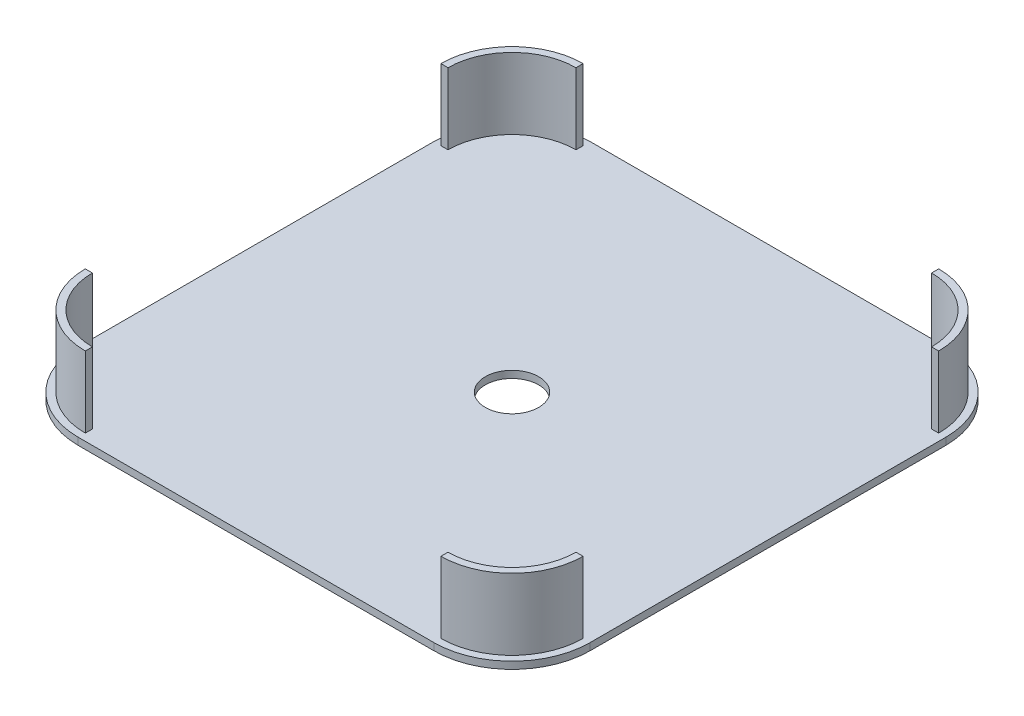
from build123d import *

# Parameters (mm, degrees)
BOSS_EXTRU_1_DEPTH      = 2
BOSS_EXTRU_2_DEPTH      = 20
ESQUISSE4_R             = 7.5
ENL_V_MAT_EXTRU_1_DEPTH = 138.403473125


with BuildPart() as part:
    # Esquisse1 → Boss.-Extru.1 (new body)
    with BuildSketch(Plane(origin=(0, 0, 0), x_dir=(1, 0, 0), z_dir=(0, 1, 0))):
        with BuildLine():
            Line((-56.655462185, 33.12605042), (43.344537815, 33.12605042))
            ThreePointArc((43.344537815, 33.12605042), (58.900887001, 26.682399606), (65.344537815, 11.12605042))
            Line((65.344537815, 11.12605042), (65.344537815, -88.87394958))
            ThreePointArc((65.344537815, -88.87394958), (58.900887001, -104.430298766), (43.344537815, -110.87394958))
            Line((43.344537815, -110.87394958), (-56.655462185, -110.87394958))
            ThreePointArc((-56.655462185, -110.87394958), (-72.211811371, -104.430298766), (-78.655462185, -88.87394958))
            Line((-78.655462185, -88.87394958), (-78.655462185, 11.12605042))
            ThreePointArc((-78.655462185, 11.12605042), (-72.211811371, 26.682399606), (-56.655462185, 33.12605042))
        make_face()
    extrude(amount=BOSS_EXTRU_1_DEPTH)

    # Esquisse3 → Boss.-Extru.2 (add)
    with BuildSketch(Plane(origin=(0, 2, 0), x_dir=(1, 0, 0), z_dir=(0, 1, 0))):
        with BuildLine():
            Line((43.344537815, 31.12605042), (43.344537815, 29.12605042))
            ThreePointArc((43.344537815, 29.12605042), (56.072459876, 23.853972482), (61.344537815, 11.12605042))
            Line((61.344537815, 11.12605042), (63.344537815, 11.12605042))
            ThreePointArc((63.344537815, 11.12605042), (57.486673439, 25.268186044), (43.344537815, 31.12605042))
        make_face()
        with BuildLine():
            Line((43.344537815, -106.87394958), (43.344537815, -108.87394958))
            ThreePointArc((43.344537815, -108.87394958), (57.486673439, -103.016085204), (63.344537815, -88.87394958))
            Line((63.344537815, -88.87394958), (61.344537815, -88.87394958))
            ThreePointArc((61.344537815, -88.87394958), (56.072459876, -101.601871641), (43.344537815, -106.87394958))
        make_face()
        with BuildLine():
            Line((-76.655462185, -88.87394958), (-74.655462185, -88.87394958))
            ThreePointArc((-74.655462185, -88.87394958), (-69.383384246, -101.601871641), (-56.655462185, -106.87394958))
            Line((-56.655462185, -106.87394958), (-56.655462185, -108.87394958))
            ThreePointArc((-56.655462185, -108.87394958), (-70.797597809, -103.016085204), (-76.655462185, -88.87394958))
        make_face()
        with BuildLine():
            Line((-76.655462185, 11.12605042), (-74.655462185, 11.12605042))
            ThreePointArc((-74.655462185, 11.12605042), (-69.383384246, 23.853972482), (-56.655462185, 29.12605042))
            Line((-56.655462185, 29.12605042), (-56.655462185, 31.12605042))
            ThreePointArc((-56.655462185, 31.12605042), (-70.797597809, 25.268186044), (-76.655462185, 11.12605042))
        make_face()
    extrude(amount=BOSS_EXTRU_2_DEPTH)

    # Esquisse4 → Enlèv. mat.-Extru.1 (cut, through all)
    with BuildSketch(Plane(origin=(0, 2, 0), x_dir=(1, 0, 0), z_dir=(0, 1, 0))):
        with Locations(Location((-6.655462185, -38.87394958, 0), (0, 0, 270))):
            Circle(ESQUISSE4_R)
    extrude(amount=-ENL_V_MAT_EXTRU_1_DEPTH, mode=Mode.SUBTRACT)


solid = part.part
